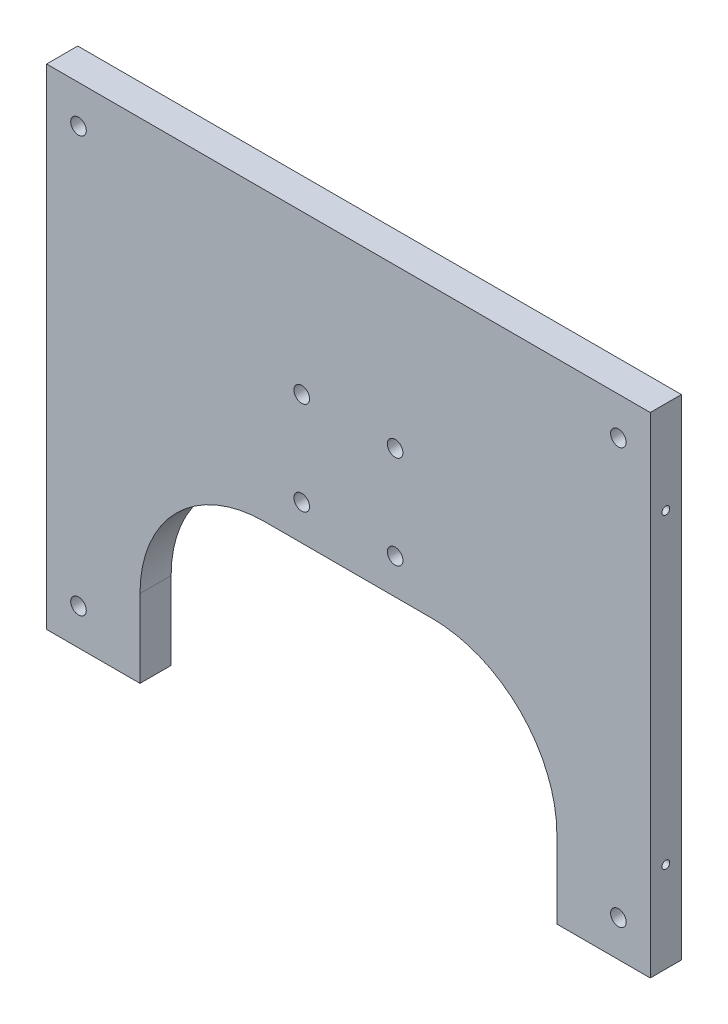
from build123d import *

# Parameters (mm, degrees)
BOSS_EXTRUDE1_DEPTH         = 12.7
F_1_4_0_25_DIAMETER_HOLE1_D = 6.35
FILLET2_R                   = 50.8
HOLE1_AT_2_COUNT            = 2
HOLE1_AT_2_PITCH            = 125.108514383


with BuildPart() as part:
    # Sketch1 → Boss-Extrude1 (new body)
    with BuildSketch(Plane.XY):
        Polygon((258.933482757, 10.713854335), (12.7, 10.713854335), (12.7, -189.051843155), (50.8, -189.051843155), (50.8, -106.501843155), (220.833482757, -106.501843155), (220.833482757, -189.051843155), (258.933482757, -189.051843155), align=None)
    extrude(amount=-BOSS_EXTRUDE1_DEPTH)

    # 1/4 (0.25) Diameter Hole1 (through all)
    with Locations(Plane(origin=(0, 0, -12.7), x_dir=(-1, 0, 0), z_dir=(0, 0, -1))):
        with Locations((-25.706162889, -174.233423282), (-116.766741379, -92.064314729), (-154.866741379, -92.064314729), (-245.927319868, -174.233423282), (-154.866741379, -53.964314729), (-245.927319868, -4.747970506), (-116.766741379, -53.964314729), (-25.706162889, -4.747970506)):
            Hole(F_1_4_0_25_DIAMETER_HOLE1_D / 2)

    # Fillet2
    fillet2_edges = [part.edges().sort_by_distance(p)[0] for p in [
        (220.833482757, -106.501843155, -6.35),
        (50.8, -106.501843155, -6.35),
    ]]
    fillet(fillet2_edges, radius=FILLET2_R)

    # Sketch7 → Hole1 (revolve, cut)
    with BuildSketch(Plane(origin=(0, -152.193459623, -6.35), x_dir=(0, 0, 1), z_dir=(0, 1, 0))):
        Polygon((0, 0), (0, 39.053866233), (1.5875, 38.1), (1.5875, 4.017661662), (5.08, 0), align=None)
    hole1 = revolve(axis=Axis((-14.308894879, -152.193459623, -6.35), (1, 0, 0)), mode=Mode.SUBTRACT)

    # Hole1 at 2: Hole1 ×2
    with Locations(*[(0, i * HOLE1_AT_2_PITCH, 0) for i in range(1, HOLE1_AT_2_COUNT)]):
        add(hole1, mode=Mode.SUBTRACT)

    # Mirror1: Hole1 across plane
    add(hole1.mirror(Plane.ZY.offset(-135.816741379)), mode=Mode.SUBTRACT)

    # Mirror1 copy 1 sketch → Mirror1 copy 1 (revolve, cut)
    with BuildSketch(Plane(origin=(271.633482757, -27.084945239, -6.35), x_dir=(0, 0, 1), z_dir=(0, 1, 0))):
        Polygon((0, 0), (0, -39.053866233), (1.5875, -38.1), (1.5875, -4.017661662), (5.08, 0), align=None)
    revolve(axis=Axis((285.942377636, -27.084945239, -6.35), (1, 0, 0)), mode=Mode.SUBTRACT)


solid = part.part
